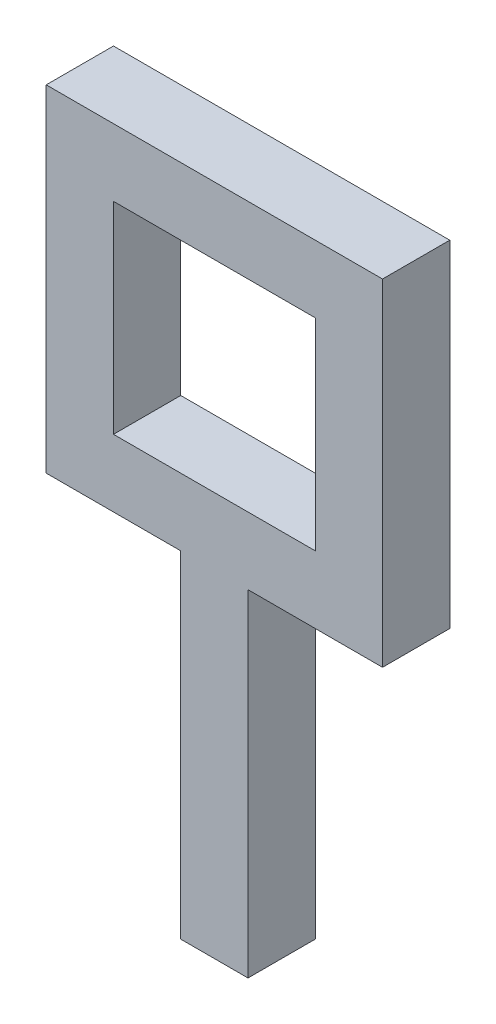
from build123d import *

# Parameters (mm, degrees)
SKETCH1_W           = 2
SKETCH1_H           = 2
BOSS_EXTRUDE1_DEPTH = 10
SKETCH2_W           = 10
SKETCH2_H           = 2
BOSS_EXTRUDE2_DEPTH = 10
SKETCH3_W           = 6
SKETCH3_H           = 6
CUT_EXTRUDE1_DEPTH  = 21.712315177


with BuildPart() as part:
    # Sketch1 → Boss-Extrude1 (new body)
    with BuildSketch(Plane(origin=(0, 0, 0), x_dir=(1, 0, 0), z_dir=(0, 1, 0))):
        Rectangle(SKETCH1_W, SKETCH1_H)
    extrude(amount=BOSS_EXTRUDE1_DEPTH)

    # Sketch2 → Boss-Extrude2 (add)
    with BuildSketch(Plane(origin=(0, 10, 0), x_dir=(-1, 0, 0), z_dir=(0, 1, 0))):
        Rectangle(SKETCH2_W, SKETCH2_H)
    extrude(amount=BOSS_EXTRUDE2_DEPTH)

    # Sketch3 → Cut-Extrude1 (cut, through all)
    with BuildSketch(Plane.XY.offset(1)):
        with Locations((0, 15)):
            Rectangle(SKETCH3_W, SKETCH3_H)
    extrude(amount=-CUT_EXTRUDE1_DEPTH, mode=Mode.SUBTRACT)


solid = part.part
